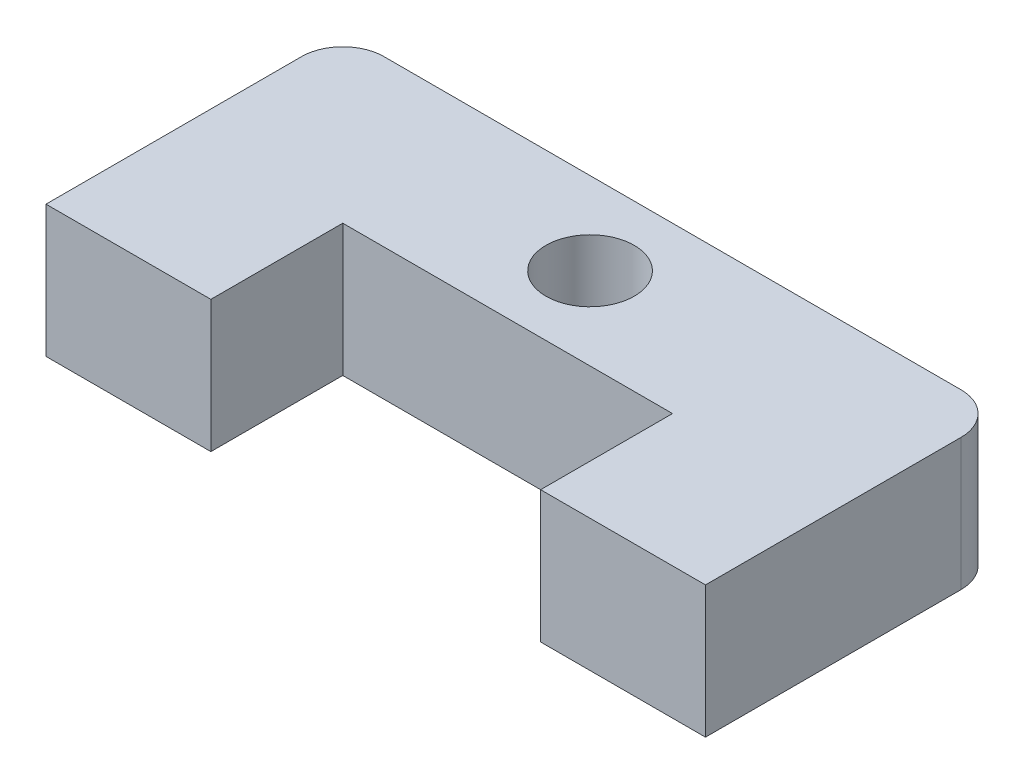
from build123d import *

# Parameters (mm, degrees)
SKETCH1_R           = 1.7
BOSS_EXTRUDE1_DEPTH = 5.08
FILLET1_R           = 1.5875


with BuildPart() as part:
    # Sketch1 → Boss-Extrude1 (new body)
    with BuildSketch(Plane(origin=(0, 0, 0), x_dir=(1, 0, 0), z_dir=(0, 1, 0))):
        Polygon((-12.7, -3.175), (-12.7, -8.255), (-6.35, -8.255), (-6.35, -3.175), (6.35, -3.175), (6.35, -8.255), (12.7, -8.255), (12.7, -3.175), (12.7, 3.175), (-12.7, 3.175), align=None)
        with Locations(Location((0, 0, 0), (0, 0, 270))):
            Circle(SKETCH1_R, mode=Mode.SUBTRACT)
    extrude(amount=BOSS_EXTRUDE1_DEPTH)

    # Fillet1
    fillet1_edges = [part.edges().sort_by_distance(p)[0] for p in [
        (-12.7, 2.54, -3.175),
        (12.7, 2.54, -3.175),
    ]]
    fillet(fillet1_edges, radius=FILLET1_R)


solid = part.part
